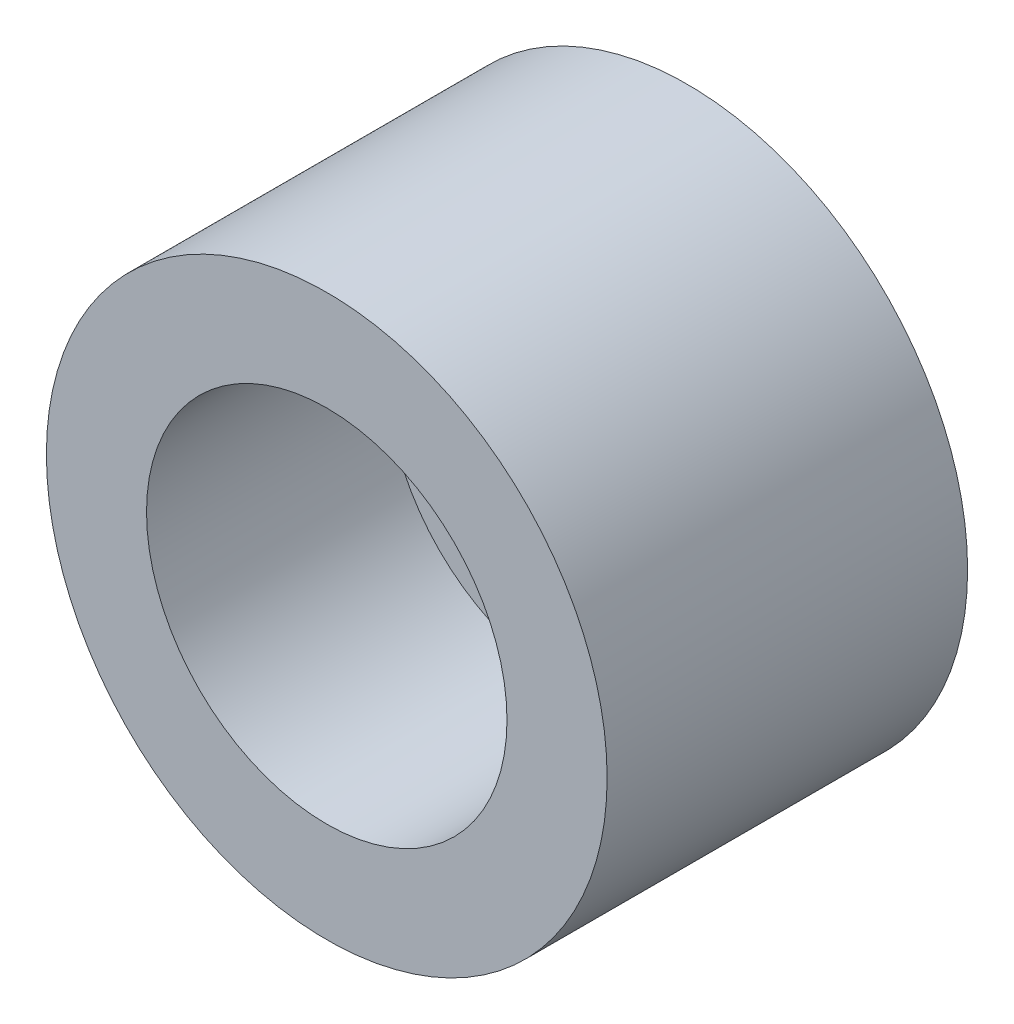
from build123d import *

# Parameters (mm, degrees)
SKETCH1_R           = 3.5
BOSS_EXTRUDE1_DEPTH = 4.5
SKETCH3_R           = 2.25
CUT_EXTRUDE1_DEPTH  = 3


with BuildPart() as part:
    # Sketch1 → Boss-Extrude1 (new body)
    with BuildSketch(Plane.XY):
        Circle(SKETCH1_R)
    extrude(amount=BOSS_EXTRUDE1_DEPTH)

    # Sketch3 → Cut-Extrude1 (cut)
    with BuildSketch(Plane.XY.offset(4.5)):
        Circle(SKETCH3_R)
    extrude(amount=-CUT_EXTRUDE1_DEPTH, mode=Mode.SUBTRACT)


solid = part.part
